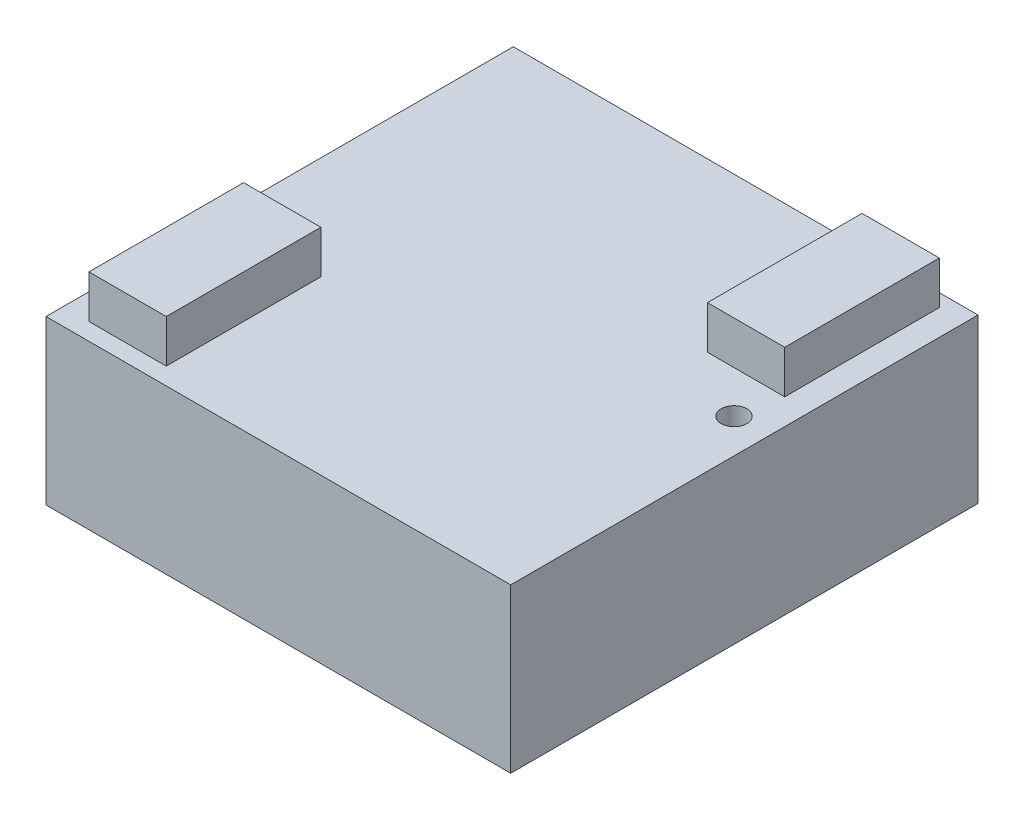
from build123d import *

# Parameters (mm, degrees)
ESQUISSE1_W             = 54.1
ESQUISSE1_H             = 54.4
BOSS_EXTRU_1_DEPTH      = 19
ESQUISSE2_W             = 20
ESQUISSE2_H             = 12
BOSS_EXTRU_2_DEPTH      = 15
ESQUISSE3_W             = 9
ESQUISSE3_H             = 18
BOSS_EXTRU_3_DEPTH      = 5
ESQUISSE4_R             = 1.5
ENL_V_MAT_EXTRU_1_DEPTH = 81.387623426


with BuildPart() as part:
    # Esquisse1 → Boss.-Extru.1 (new body)
    with BuildSketch(Plane(origin=(0, 0, 0), x_dir=(1, 0, 0), z_dir=(0, 1, 0))):
        with Locations((27.05, 27.2)):
            Rectangle(ESQUISSE1_W, ESQUISSE1_H)
    extrude(amount=BOSS_EXTRU_1_DEPTH)

    # Esquisse2 → Boss.-Extru.2 (add)
    with BuildSketch(Plane.XZ):
        with Locations((27, -28.4)):
            Rectangle(ESQUISSE2_W, ESQUISSE2_H)
    extrude(amount=BOSS_EXTRU_2_DEPTH)

    # Esquisse3 → Boss.-Extru.3 (add)
    with BuildSketch(Plane(origin=(0, 19, 0), x_dir=(1, 0, 0), z_dir=(0, 1, 0))):
        with Locations((46.6, 43.9)):
            Rectangle(ESQUISSE3_W, ESQUISSE3_H)
        with Locations((7.5, 11)):
            Rectangle(ESQUISSE3_W, ESQUISSE3_H)
    extrude(amount=BOSS_EXTRU_3_DEPTH)

    # Esquisse4 → Enlèv. mat.-Extru.1 (cut, through all)
    with BuildSketch(Plane.XZ):
        with Locations(Location((50.1, -30, 0), (0, 0, 270))):
            Circle(ESQUISSE4_R)
    extrude(amount=-ENL_V_MAT_EXTRU_1_DEPTH, mode=Mode.SUBTRACT)


solid = part.part
